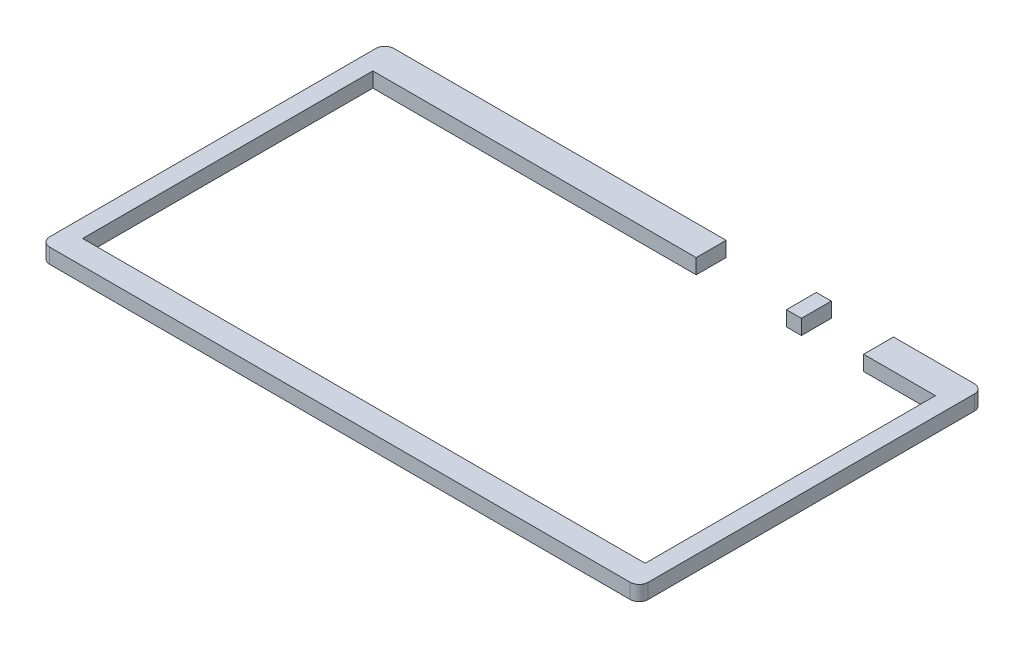
from build123d import *

# Parameters (mm, degrees)
SKETCH1_W             = 6.35
SKETCH1_H             = 12.7
BOSS_EXTRUDE1_DEPTH   = 6.35
BOSS_EXTRUDE1_2_DEPTH = 6.35


with BuildPart() as part:
    # Sketch1 → Boss-Extrude1 (new body)
    with BuildSketch(Plane(origin=(0, 0, 0), x_dir=(1, 0, 0), z_dir=(0, 1, 0))):
        with Locations((186.325, 139.7)):
            Rectangle(SKETCH1_W, SKETCH1_H)
    extrude(amount=BOSS_EXTRUDE1_DEPTH)


with BuildPart() as body_2:
    # Sketch1 → Boss-Extrude1 2 (new body)
    with BuildSketch(Plane(origin=(0, 0, 0), x_dir=(1, 0, 0), z_dir=(0, 1, 0))):
        with BuildLine():
            Line((3.81, 0), (250.19, 0))
            ThreePointArc((250.19, 0), (252.884076836, 1.115923164), (254, 3.81))
            Line((254, 3.81), (254, 142.24))
            ThreePointArc((254, 142.24), (252.884076836, 144.934076836), (250.19, 146.05))
            Line((250.19, 146.05), (215.9, 146.05))
            Line((215.9, 146.05), (215.9, 133.35))
            Line((215.9, 133.35), (246.38, 133.35))
            Line((246.38, 133.35), (246.38, 10.16))
            Line((246.38, 10.16), (7.62, 10.16))
            Line((7.62, 10.16), (7.62, 133.35))
            Line((7.62, 133.35), (144.85, 133.35))
            Line((144.85, 133.35), (144.85, 146.05))
            Line((144.85, 146.05), (3.81, 146.05))
            ThreePointArc((3.81, 146.05), (1.115923164, 144.934076836), (0, 142.24))
            Line((0, 142.24), (0, 3.81))
            ThreePointArc((0, 3.81), (1.115923164, 1.115923164), (3.81, 0))
        make_face()
    extrude(amount=BOSS_EXTRUDE1_2_DEPTH)


solid = Compound([part.part, body_2.part])
